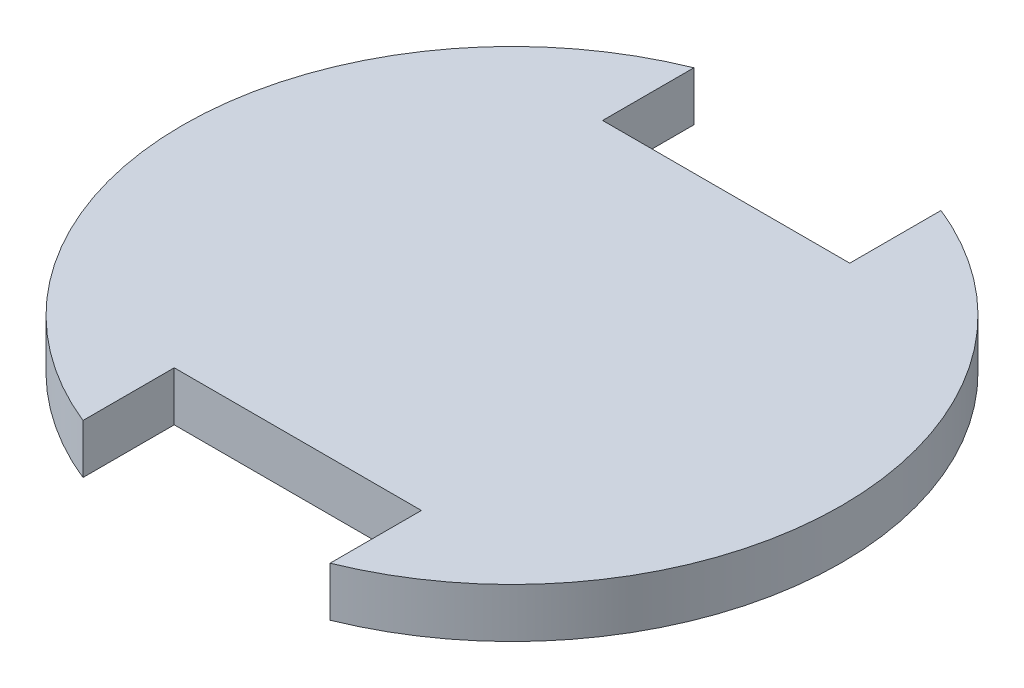
from build123d import *

# Parameters (mm, degrees)
SKETCH1_R           = 20
BOSS_EXTRUDE1_DEPTH = 1.5
SKETCH3_W           = 15
SKETCH3_H           = 10
CUT_EXTRUDE2_DEPTH  = 3


with BuildPart() as part:
    # Sketch1 → Boss-Extrude1 (new, symmetric)
    with BuildSketch(Plane(origin=(0, 0, 0), x_dir=(1, 0, 0), z_dir=(0, 1, 0))):
        with Locations(Location((0, 0, 0), (0, 0, 270))):
            Circle(SKETCH1_R)
    extrude(amount=BOSS_EXTRUDE1_DEPTH, both=True)

    # Sketch3 → Cut-Extrude2 (cut)
    with BuildSketch(Plane(origin=(0, 1.5, 0), x_dir=(1, 0, 0), z_dir=(0, 1, 0))):
        with Locations((0, 18)):
            Rectangle(SKETCH3_W, SKETCH3_H)
    cut_extrude2 = extrude(amount=-CUT_EXTRUDE2_DEPTH, mode=Mode.SUBTRACT)

    # Mirror1: Cut-Extrude2 across plane
    add(cut_extrude2.mirror(Plane.XY), mode=Mode.SUBTRACT)


solid = part.part
